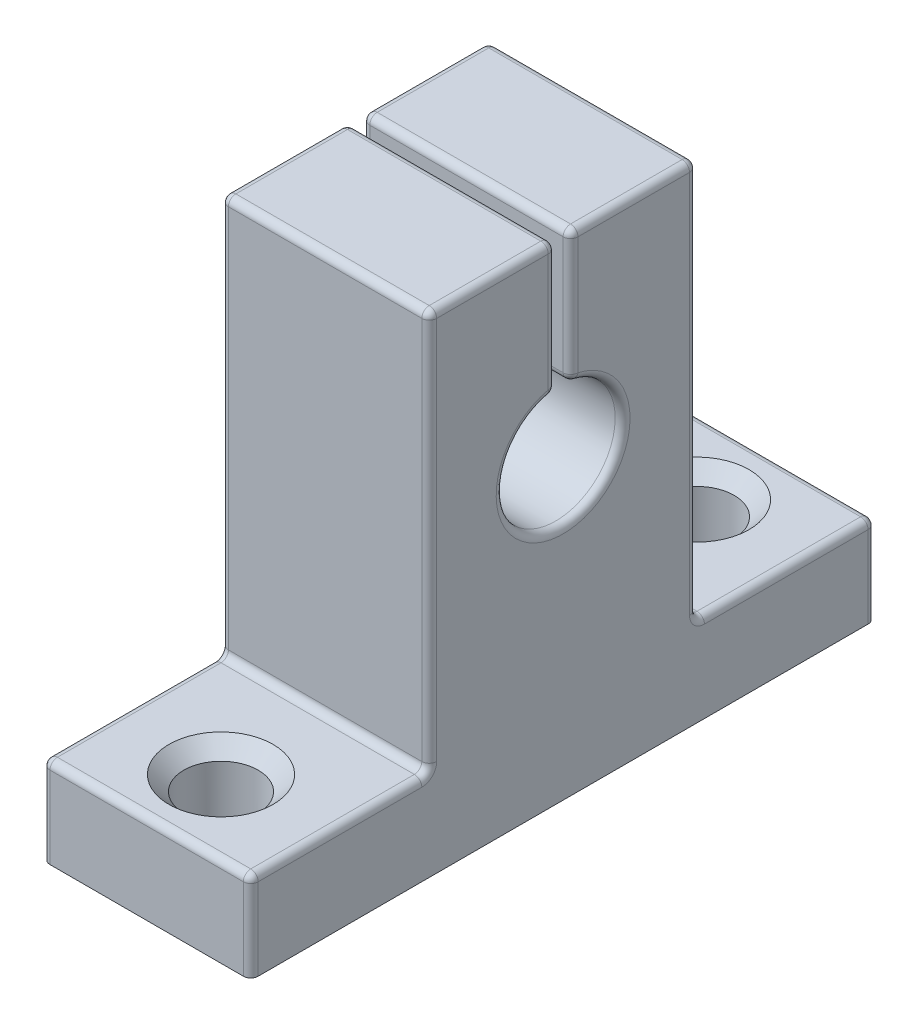
from build123d import *

# Parameters (mm, degrees)
BOSS_EXTRUDE1_DEPTH = 7
SKETCH3_R           = 2.5
CUT_EXTRUDE1_DEPTH  = 6
FILLET2_R           = 0.5
CHAMFER1_SIZE       = 1


with BuildPart() as part:
    # Sketch1 → Boss-Extrude1 (new, symmetric)
    with BuildSketch(Plane(origin=(0, 0, 0), x_dir=(0, 0, -1), z_dir=(1, 0, 0))):
        with BuildLine():
            Line((-21, 0), (21, 0))
            Line((21, 0), (21, 6))
            Line((21, 6), (9, 6))
            Line((9, 6), (9, 32.8))
            Line((9, 32.8), (0.5, 32.8))
            Line((0.5, 32.8), (0.5, 23.968626967))
            ThreePointArc((0.5, 23.968626967), (0, 16), (-0.5, 23.968626967))
            Line((-0.5, 23.968626967), (-0.5, 32.8))
            Line((-0.5, 32.8), (-9, 32.8))
            Line((-9, 32.8), (-9, 6))
            Line((-9, 6), (-21, 6))
            Line((-21, 6), (-21, 0))
        make_face()
    extrude(amount=BOSS_EXTRUDE1_DEPTH, both=True)

    # Sketch3 → Cut-Extrude1 (cut)
    with BuildSketch(Plane(origin=(0, 6, 0), x_dir=(1, 0, 0), z_dir=(0, 1, 0))):
        with Locations(Location((0, 16, 0), (0, 0, 270))):
            Circle(SKETCH3_R)
        with Locations(Location((0, -16, 0), (0, 0, 270))):
            Circle(SKETCH3_R)
    extrude(amount=-CUT_EXTRUDE1_DEPTH, mode=Mode.SUBTRACT)

    # Fillet2
    fillet2_edges = [part.edges().sort_by_distance(p)[0] for p in [
        (-7, 6, 15),
        (-7, 19.4, 9),
        (7, 3, -21),
        (-7, 32.8, 4.75),
        (-7, 28.384313483, 0.5),
        (-7, 16, 0),
        (-7, 28.384313483, -0.5),
        (-7, 32.8, -4.75),
        (-7, 19.4, -9),
        (-7, 6, -15),
        (-7, 3, -21),
        (-7, 3, 21),
        (7, 6, -15),
        (0, 6, 21),
        (0, 6, 9),
        (0, 32.8, 9),
        (7, 19.4, -9),
        (0, 32.8, 0.5),
        (0, 23.968626967, 0.5),
        (0, 23.968626967, -0.5),
        (0, 32.8, -0.5),
        (0, 32.8, -9),
        (0, 6, -9),
        (0, 6, -21),
        (7, 32.8, -4.75),
        (7, 28.384313483, -0.5),
        (7, 16, 0),
        (7, 28.384313483, 0.5),
        (7, 32.8, 4.75),
        (7, 19.4, 9),
        (7, 6, 15),
        (7, 3, 21),
    ]]
    fillet(fillet2_edges, radius=FILLET2_R)

    # Chamfer1
    chamfer1_edges = [part.edges().sort_by_distance(p)[0] for p in [
        (0, 6, -18.5),
        (0, 6, 13.5),
    ]]
    chamfer(chamfer1_edges, length=CHAMFER1_SIZE)


solid = part.part
